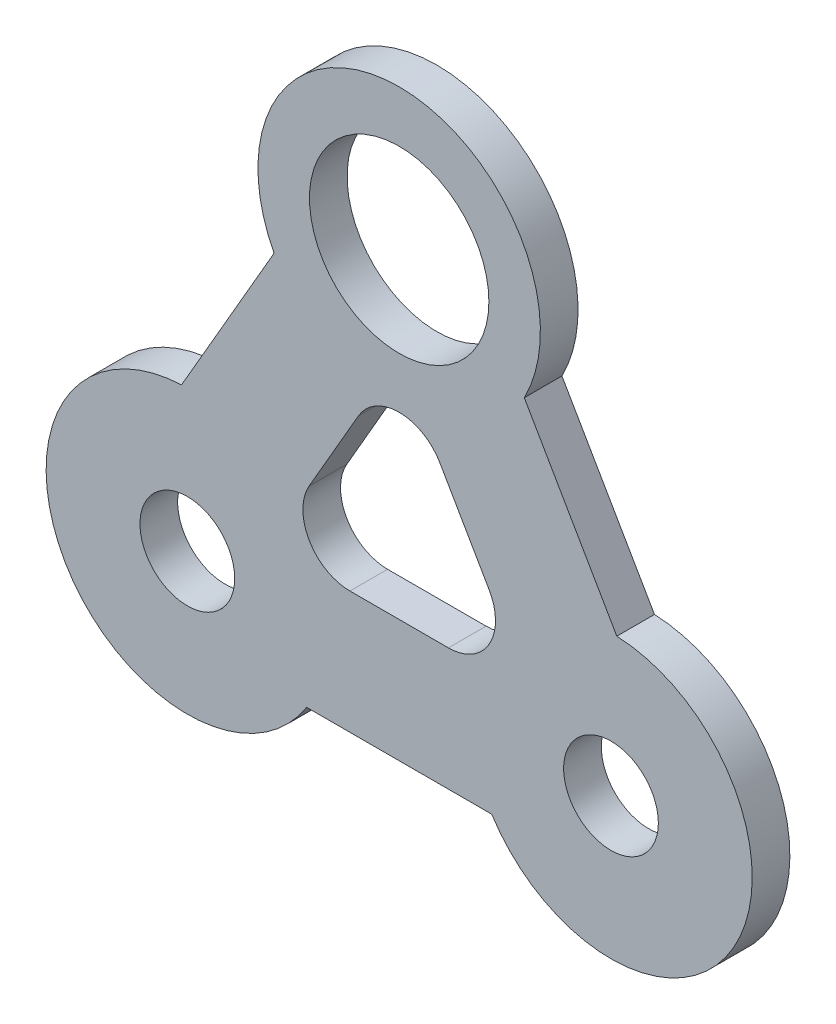
from build123d import *

# Parameters (mm, degrees)
SKETCH_1_R      = 9.53
SKETCH_1_R_2    = 5.03
EXTRUDE_1_DEPTH = 4


with BuildPart() as part:
    # 草图1 → 凸台-拉伸1 (new body)
    with BuildSketch(Plane.XY):
        with BuildLine():
            Line((-18.494622549, 4.742999843), (-23.409453688, -3.769737399))
            ThreePointArc((-23.409453688, -3.769737399), (-35.781809628, -26.257000157), (-10.121090849, -26.785856986))
            Line((-10.121090849, -26.785856986), (-0.291428571, -26.785856986))
            Line((-0.291428571, -26.785856986), (9.538233706, -26.785856986))
            ThreePointArc((9.538233706, -26.785856986), (35.198952485, -26.257000157), (22.826596545, -3.769737399))
            Line((22.826596545, -3.769737399), (17.911765406, 4.742999843))
            Line((17.911765406, 4.742999843), (12.996934268, 13.255737086))
            ThreePointArc((12.996934268, 13.255737086), (-0.291428571, 35.214143014), (-13.579791411, 13.255737086))
            Line((-13.579791411, 13.255737086), (-18.494622549, 4.742999843))
        make_face()
        with Locations((-0.291428571, 20.214143014)):
            Circle(SKETCH_1_R, mode=Mode.SUBTRACT)
        with Locations((22.208571429, -18.757000157)):
            Circle(SKETCH_1_R_2, mode=Mode.SUBTRACT)
        with Locations((-22.791428571, -18.757000157)):
            Circle(SKETCH_1_R_2, mode=Mode.SUBTRACT)
        with BuildLine():
            Line((9.268171867, -6.285856986), (4.038698447, 2.771856673))
            ThreePointArc((4.038698447, 2.771856673), (-0.291428571, 5.271856673), (-4.62155559, 2.771856673))
            Line((-4.62155559, 2.771856673), (-9.85102901, -6.285856986))
            ThreePointArc((-9.85102901, -6.285856986), (-9.85102901, -11.285856986), (-5.520901991, -13.785856986))
            Line((-5.520901991, -13.785856986), (4.938044848, -13.785856986))
            ThreePointArc((4.938044848, -13.785856986), (9.268171867, -11.285856986), (9.268171867, -6.285856986))
        make_face(mode=Mode.SUBTRACT)
    extrude(amount=EXTRUDE_1_DEPTH)


solid = part.part
